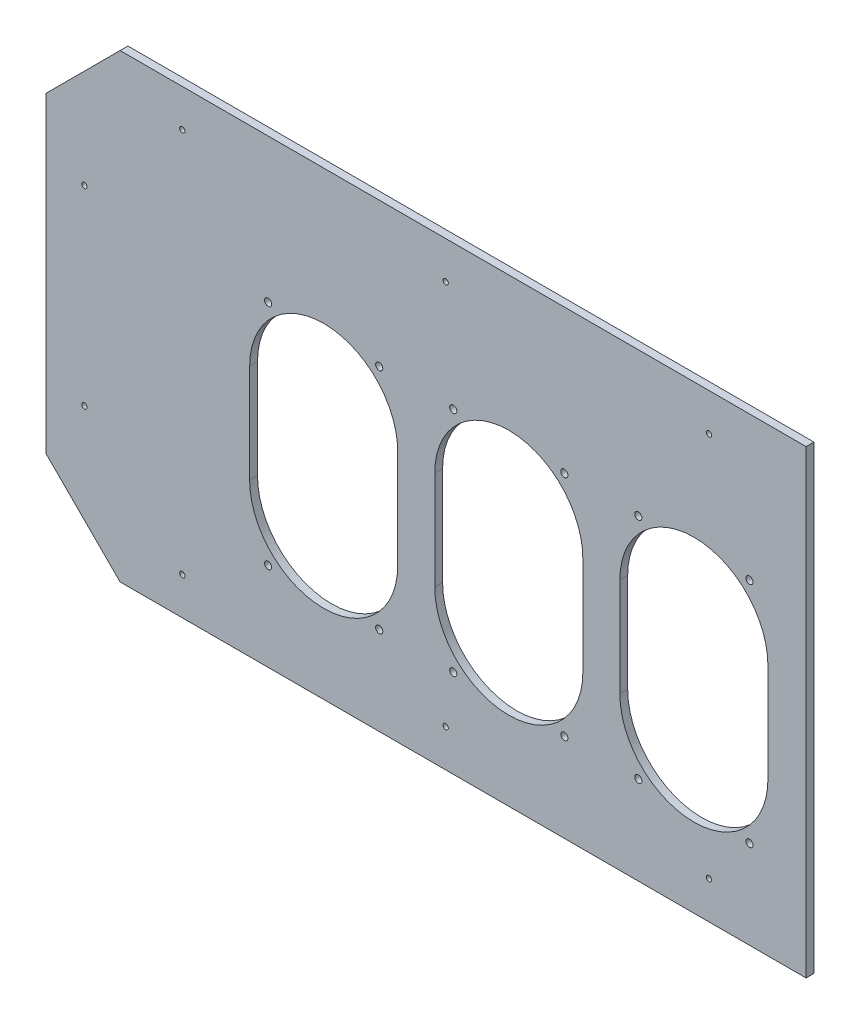
from build123d import *

# Parameters (mm, degrees)
ESQUISSE1_W                = 614.6
ESQUISSE1_H                = 372.95
BOSS_EXTRU_1_DEPTH         = 3.175
ENL_V_MAT_EXTRU_1_DEPTH    = 360.508745547
D_GAGEMENT_121_D           = 5.7912
R_P_TITION_LIN_AIRE1_COUNT = 3
R_P_TITION_LIN_AIRE1_PITCH = 150
ENL_V_MAT_EXTRU_2_DEPTH    = 360.508745547
ESQUISSE10_W               = 1.35
ESQUISSE10_H               = 372.95
BOSS_EXTRU_3_DEPTH         = 6.35
D_GAGEMENT_61_D            = 4.3053


with BuildPart() as part:
    # Esquisse1 → Boss.-Extru.1 (new, symmetric)
    with BuildSketch(Plane.XY):
        Rectangle(ESQUISSE1_W, ESQUISSE1_H)
    extrude(amount=BOSS_EXTRU_1_DEPTH, both=True)

    # Esquisse2 → Enlèv. mat.-Extru.1 (cut, through all)
    with BuildSketch(Plane.XY.offset(3.175)):
        with BuildLine():
            Line((-22.3, 17.475), (-22.3, -62.525))
            ThreePointArc((-22.3, -62.525), (-82.3, -122.525), (-142.3, -62.525))
            Line((-142.3, -62.525), (-142.3, 17.475))
            ThreePointArc((-142.3, 17.475), (-82.3, 77.475), (-22.3, 17.475))
        make_face()
    enl_v_mat_extru_1 = extrude(amount=-ENL_V_MAT_EXTRU_1_DEPTH, mode=Mode.SUBTRACT)

    # Dégagement #121 (through all)
    with Locations(Plane.XY.offset(3.175)):
        with Locations((-127.3, -114.831787322), (-37.3, -114.831787322), (-37.3, 69.781787322), (-127.3, 69.781787322)):
            d_gagement_121 = Hole(D_GAGEMENT_121_D / 2)

    # Répétition linéaire1: Enlèv. mat.-Extru.1, Dégagement #121 ×3
    with Locations(*[(i * R_P_TITION_LIN_AIRE1_PITCH, 0, 0) for i in range(1, R_P_TITION_LIN_AIRE1_COUNT)]):
        add(enl_v_mat_extru_1, mode=Mode.SUBTRACT)
        add(d_gagement_121, mode=Mode.SUBTRACT)

    # Esquisse9 → Enlèv. mat.-Extru.2 (cut, through all)
    with BuildSketch(Plane(origin=(0, 0, -3.175), x_dir=(-1, 0, 0), z_dir=(0, 0, -1))):
        Polygon((247.301989616, 186.475), (307.3, 126.476989616), (307.3, 186.475), align=None)
    enl_v_mat_extru_2 = extrude(amount=-ENL_V_MAT_EXTRU_2_DEPTH, mode=Mode.SUBTRACT)

    # Esquisse10 → Boss.-Extru.3 (add, through all)
    with BuildSketch(Plane.XY.offset(3.175)):
        with Locations((307.975, 0)):
            Rectangle(ESQUISSE10_W, ESQUISSE10_H)
    extrude(amount=-BOSS_EXTRU_3_DEPTH)

    # Dégagement #61 (through all)
    with Locations(Plane(origin=(0, 0, -3.175), x_dir=(-1, 0, 0), z_dir=(0, 0, -1))):
        with Locations((276.225000899, -77.375), (196.850000899, -156.075), (-16.549999101, -156.075), (-229.949999101, -156.075), (-229.949999101, 156.075), (-16.549999101, 156.075), (196.850000899, 156.075), (276.225000899, 77.375)):
            Hole(D_GAGEMENT_61_D / 2)

    # Symétrie1: Enlèv. mat.-Extru.2 across plane
    add(enl_v_mat_extru_2.mirror(Plane.ZX), mode=Mode.SUBTRACT)


solid = part.part
